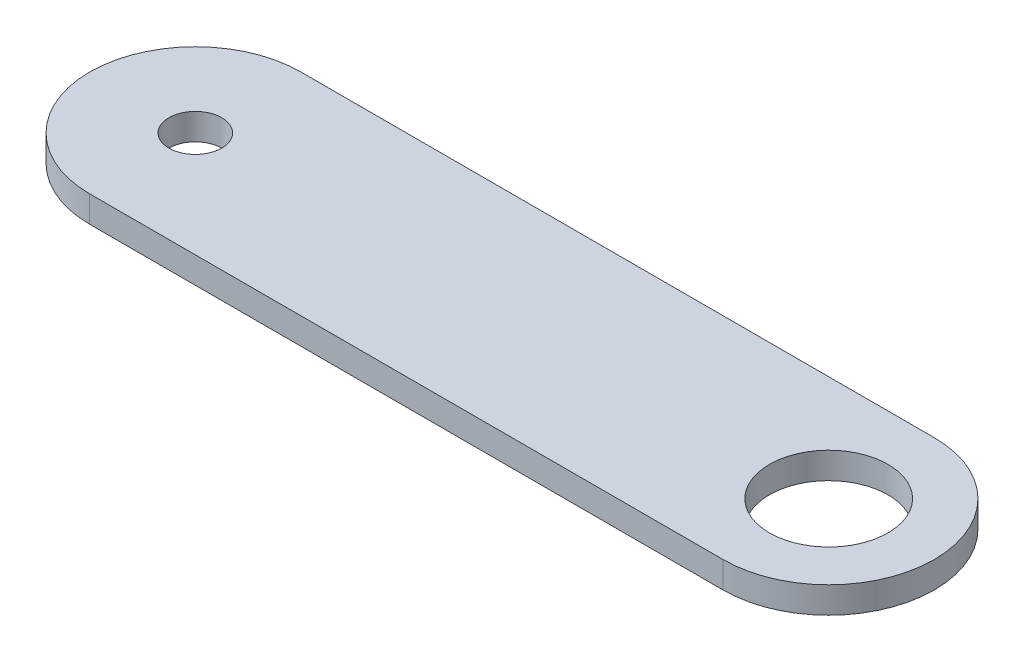
from build123d import *

# Parameters (mm, degrees)
SKETCH1_R           = 1.5875
SKETCH1_R_2         = 3.5687
BOSS_EXTRUDE1_DEPTH = 1.5875


with BuildPart() as part:
    # Sketch1 → Boss-Extrude1 (new body)
    with BuildSketch(Plane(origin=(0, 0, 0), x_dir=(1, 0, 0), z_dir=(0, 1, 0))):
        with BuildLine():
            Line((19.05, -6.35), (-19.05, -6.35))
            ThreePointArc((-19.05, -6.35), (-25.4, 0), (-19.05, 6.35))
            Line((-19.05, 6.35), (19.05, 6.35))
            ThreePointArc((19.05, 6.35), (25.4, 0), (19.05, -6.35))
        make_face()
        with Locations(Location((-19.05, 0, 0), (0, 0, 270))):
            Circle(SKETCH1_R, mode=Mode.SUBTRACT)
        with Locations(Location((19.05, 0, 0), (0, 0, 270))):
            Circle(SKETCH1_R_2, mode=Mode.SUBTRACT)
    extrude(amount=BOSS_EXTRUDE1_DEPTH)


solid = part.part
